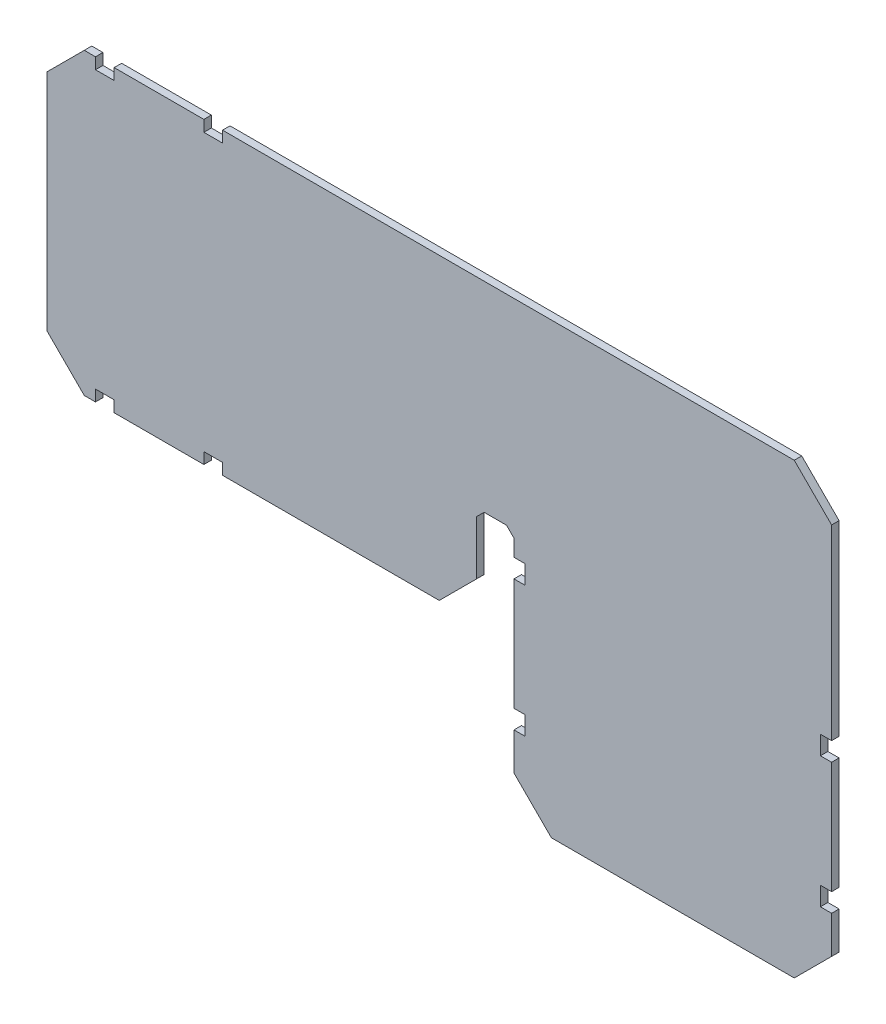
from build123d import *

# Parameters (mm, degrees)
BOSS_EXTRUDE1_DEPTH = 2
CHAMFER1_SIZE       = 10
CHAMFER2_SIZE       = 10


with BuildPart() as part:
    # Sketch1 → Boss-Extrude1 (new body)
    with BuildSketch(Plane.XY):
        Polygon((80, 24.434280886), (82, 26.434280886), (88, 26.434280886), (90, 24.434280886), (90, 20), (93, 20), (93, 15), (90, 15), (90, 0), (90, -15), (93, -15), (93, -20), (90, -20), (90, -40), (175, -40), (175, -20), (172, -20), (172, -15), (175, -15), (175, 0), (175, 15), (172, 15), (172, 20), (175, 20), (175, 80), (12, 80), (12, 77), (7, 77), (7, 80), (-5, 80), (-17, 80), (-17, 77), (-22, 77), (-22, 80), (-35, 80), (-35, 0), (-22, 0), (-22, 3), (-17, 3), (-17, 0), (-5, 0), (7, 0), (7, 3), (12, 3), (12, 0), (80, 0), align=None)
    extrude(amount=BOSS_EXTRUDE1_DEPTH)

    # Chamfer1
    chamfer1_edges = [part.edges().sort_by_distance(p)[0] for p in [
        (-35, 0, 1),
        (-35, 80, 1),
        (175, 80, 1),
        (175, -40, 1),
        (90, -40, 1),
    ]]
    chamfer(chamfer1_edges, length=CHAMFER1_SIZE)

    # Chamfer2
    chamfer2_edges = [part.edges().sort_by_distance(p)[0] for p in [
        (80, 0, 1),
    ]]
    chamfer(chamfer2_edges, length=CHAMFER2_SIZE)


solid = part.part
